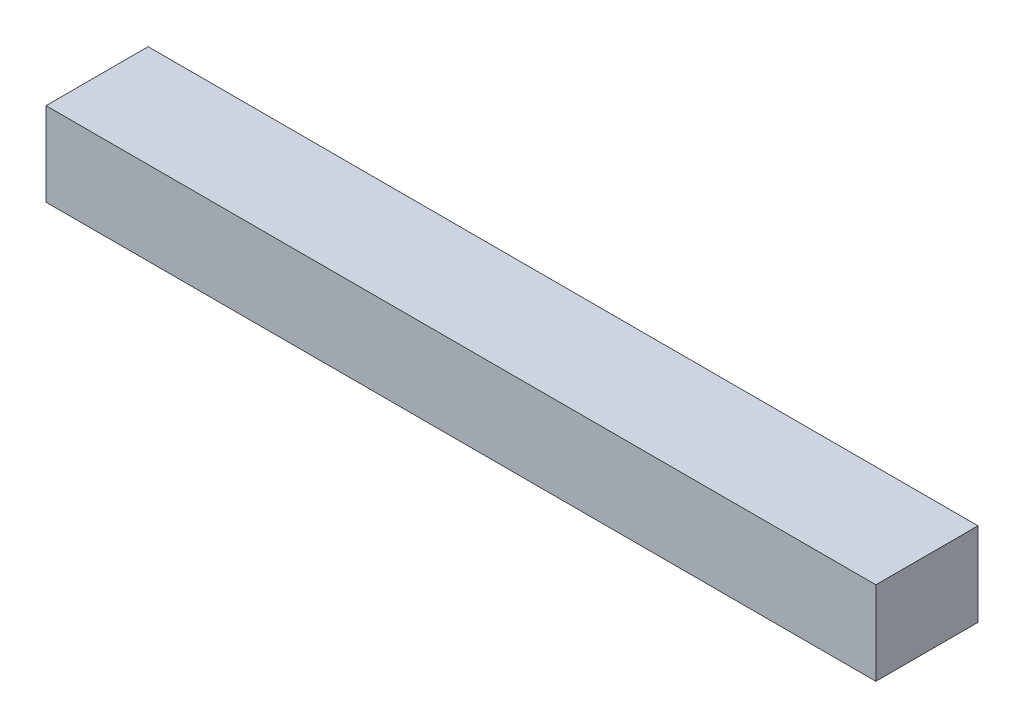
from build123d import *

# Parameters (mm, degrees)
SKETCH_1_W      = 320
SKETCH_1_H      = 262
EXTRUDE_1_DEPTH = 2600


with BuildPart() as part:
    # 草图1 → 凸台-拉伸1 (new body)
    with BuildSketch(Plane(origin=(0, 0, 0), x_dir=(0, 0, -1), z_dir=(1, 0, 0))):
        with Locations((160, 131)):
            Rectangle(SKETCH_1_W, SKETCH_1_H)
    extrude(amount=EXTRUDE_1_DEPTH)


solid = part.part
